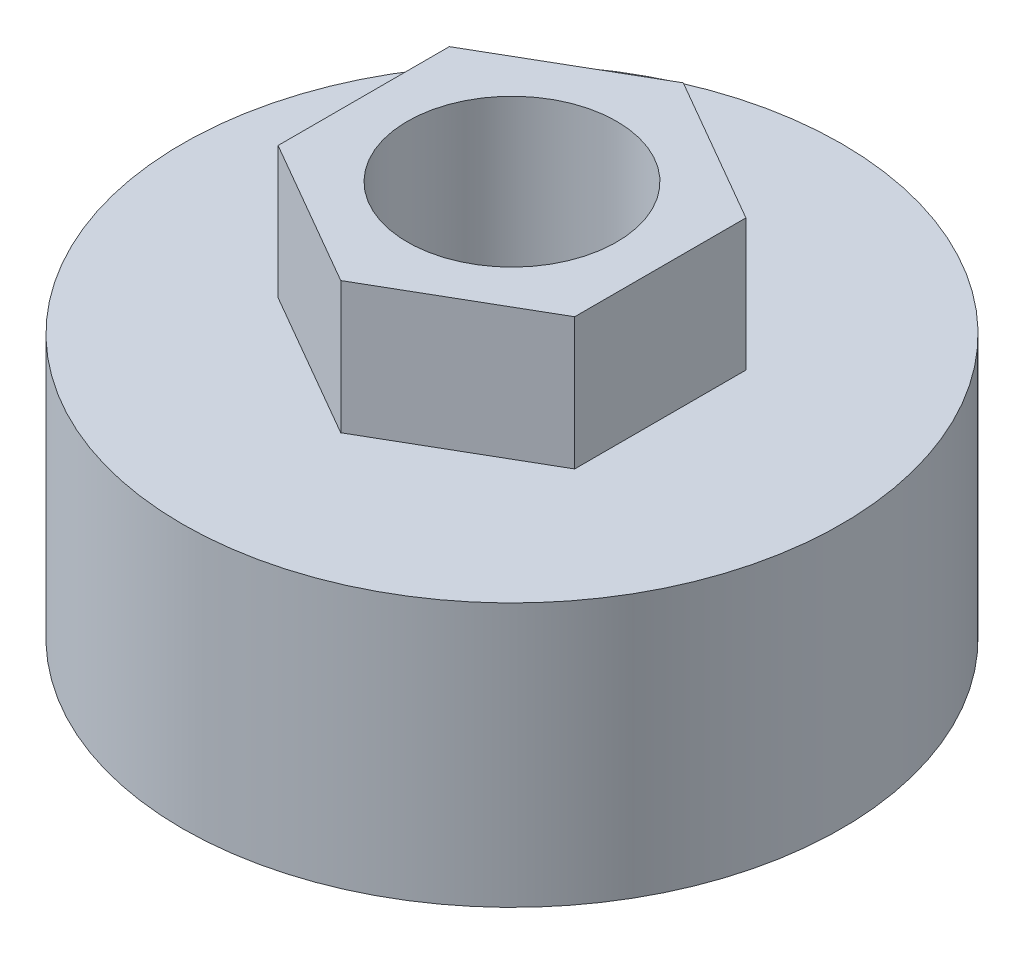
from build123d import *

# Parameters (mm, degrees)
SKETCH1_W           = 10.8331
SKETCH1_H           = 12.7
CUT_EXTRUDE1_DEPTH  = 9.525
BOSS_EXTRUDE1_DEPTH = 6.35
SKETCH5_R           = 5.0419
CUT_EXTRUDE2_DEPTH  = 26.793821935


with BuildPart() as part:
    # Sketch1 → Revolve1 (revolve)
    with BuildSketch(Plane.XY, mode=Mode.PRIVATE) as revolve1_sk:
        with Locations((10.45845, 6.35)):
            Rectangle(SKETCH1_W, SKETCH1_H)
    revolve(revolve1_sk.sketch.rotate(Axis((0, 0, 0), (0, 1, 0)), 90), axis=Axis((0, 0, 0), (0, 1, 0)))

    # Sketch3 → Cut-Extrude1 (cut)
    with BuildSketch(Plane.XZ):
        Polygon((7.62, -4.399409051), (7.62, 4.399409051), (0, 8.798818102), (-7.62, 4.399409051), (-7.62, -4.399409051), (0, -8.798818102), align=None)
    extrude(amount=-CUT_EXTRUDE1_DEPTH, mode=Mode.SUBTRACT)

    # Sketch4 → Boss-Extrude1 (add)
    with BuildSketch(Plane(origin=(0, 12.7, 0), x_dir=(1, 0, 0), z_dir=(0, 1, 0))):
        Polygon((0, 8.248891971), (-7.14375, 4.124445986), (-7.14375, -4.124445986), (0, -8.248891971), (7.14375, -4.124445986), (7.14375, 4.124445986), align=None)
    extrude(amount=BOSS_EXTRUDE1_DEPTH)

    # Sketch5 → Cut-Extrude2 (cut, through all)
    with BuildSketch(Plane.XZ.offset(-12.7)):
        with Locations(Location((0, 0, 0), (0, 0, 270))):
            Circle(SKETCH5_R)
    extrude(amount=-CUT_EXTRUDE2_DEPTH, mode=Mode.SUBTRACT)


solid = part.part
